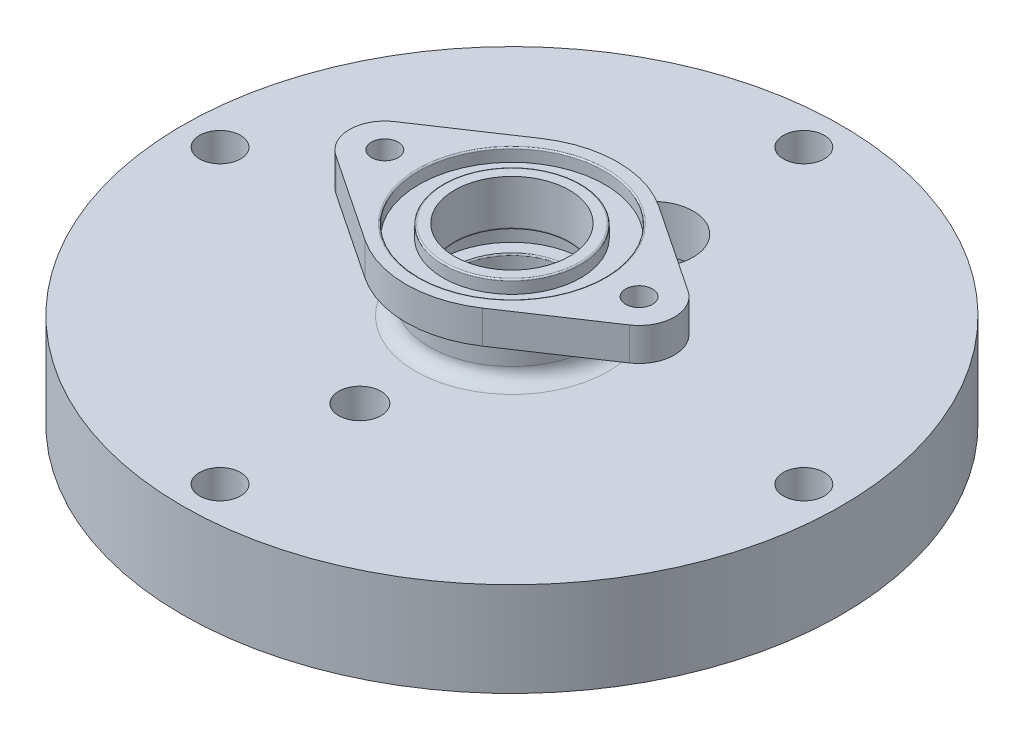
from build123d import *

# Parameters (mm, degrees)
IZIM1_R                     = 70
Y_KSEKLIK_EKSTR_ZYON1_DEPTH = 20
IZIM2_R                     = 50.03
IZIM2_R_2                   = 45
IZIM2_R_3                   = 41
IZIM2_R_4                   = 17.35
KES_EKSTR_ZYON1_DEPTH       = 10
IZIM5_R                     = 17.5
Y_KSEKLIK_EKSTR_ZYON2_DEPTH = 10
IZIM7_R                     = 2.85
Y_KSEKLIK_EKSTR_ZYON3_DEPTH = 7
IZIM8_R                     = 12.2
KES_EKSTR_ZYON3_DEPTH       = 106.683489723
IZIM9_R                     = 19.75
IZIM9_R_2                   = 14.62
KES_EKSTR_ZYON4_DEPTH       = 2.75
RADYUS1_R                   = 0.3
RADYUS2_R                   = 3
IZIM10_W                    = 3.410740466
IZIM10_H                    = 4.5
IZIM12_R                    = 4.35
KES_EKSTR_ZYON5_DEPTH       = 101.995049384
IZIM13_R                    = 8.5
KES_EKSTR_ZYON6_DEPTH       = 10
IZIM14_R                    = 50.03
IZIM14_R_2                  = 45
KES_EKSTR_ZYON7_DEPTH       = 3
IZIM15_R                    = 4.5
KES_EKSTR_ZYON9_DEPTH       = 10
IZIM16_R                    = 51
IZIM16_R_2                  = 44.25
KES_EKSTR_ZYON10_DEPTH      = 13
RADYUS3_R                   = 0.3


with BuildPart() as part:
    # Çizim1 → Yükseklik-Ekstrüzyon1 (new body)
    with BuildSketch(Plane(origin=(0, 0, 0), x_dir=(1, 0, 0), z_dir=(0, 1, 0))):
        with Locations(Location((0, 0, 0), (0, 0, 270))):
            Circle(IZIM1_R)
    extrude(amount=Y_KSEKLIK_EKSTR_ZYON1_DEPTH)

    # Çizim2 → Kes-Ekstrüzyon1 (cut)
    # profile 1 of 2: a face of its own
    with BuildSketch(Plane.XZ):
        with Locations(Location((0, 0, 0), (0, 0, 270))):
            Circle(IZIM2_R)
        with Locations(Location((0, 0, 0), (0, 0, 270))):
            Circle(IZIM2_R_2, mode=Mode.SUBTRACT)
    # profile 2 of 2: a face of its own
    with BuildSketch(Plane.XZ):
        with Locations(Location((0, 0, 0), (0, 0, 270))):
            Circle(IZIM2_R_3)
        with Locations(Location((0, 0, 0), (0, 0, 270))):
            Circle(IZIM2_R_4, mode=Mode.SUBTRACT)
    extrude(amount=-KES_EKSTR_ZYON1_DEPTH, mode=Mode.SUBTRACT)

    # Çizim4 → Kes-Döndür1 (revolve, cut)
    with BuildSketch(Plane.XY, mode=Mode.PRIVATE) as kes_d_nd_r1_sk:
        Polygon((-17.35, 10), (-17.35, 0), (-13.6, 0), align=None)
    revolve(kes_d_nd_r1_sk.sketch.rotate(Axis((0, 0, 0), (0, 1, 0)), 270), axis=Axis((0, 0, 0), (0, 1, 0)), mode=Mode.SUBTRACT)

    # Çizim5 → Yükseklik-Ekstrüzyon2 (add)
    with BuildSketch(Plane(origin=(0, 20, 0), x_dir=(1, 0, 0), z_dir=(0, 1, 0))):
        with Locations(Location((0, 0, 0), (0, 0, 270))):
            Circle(IZIM5_R)
    extrude(amount=Y_KSEKLIK_EKSTR_ZYON2_DEPTH)

    # Çizim7 → Yükseklik-Ekstrüzyon3 (add)
    with BuildSketch(Plane(origin=(0, 30, 0), x_dir=(1, 0, 0), z_dir=(0, 1, 0))):
        with BuildLine():
            Line((31.166666667, -6.236095645), (12.5, -18.708286934))
            ThreePointArc((12.5, -18.708286934), (0, -22.5), (-12.5, -18.708286934))
            Line((-12.5, -18.708286934), (-31.166666667, -6.236095645))
            ThreePointArc((-31.166666667, -6.236095645), (-34.5, 0), (-31.166666667, 6.236095645))
            Line((-31.166666667, 6.236095645), (-12.5, 18.708286934))
            ThreePointArc((-12.5, 18.708286934), (0, 22.5), (12.5, 18.708286934))
            Line((12.5, 18.708286934), (31.166666667, 6.236095645))
            ThreePointArc((31.166666667, 6.236095645), (34.5, 0), (31.166666667, -6.236095645))
        make_face()
        with Locations(Location((-27, 0, 0), (0, 0, 270))):
            Circle(IZIM7_R, mode=Mode.SUBTRACT)
        with Locations(Location((27, 0, 0), (0, 0, 270))):
            Circle(IZIM7_R, mode=Mode.SUBTRACT)
    extrude(amount=Y_KSEKLIK_EKSTR_ZYON3_DEPTH)

    # Çizim8 → Kes-Ekstrüzyon3 (cut, through all)
    with BuildSketch(Plane(origin=(0, 37, 0), x_dir=(1, 0, 0), z_dir=(0, 1, 0))):
        with Locations(Location((0, 0, 0), (0, 0, 270))):
            Circle(IZIM8_R)
    extrude(amount=-KES_EKSTR_ZYON3_DEPTH, mode=Mode.SUBTRACT)

    # Çizim9 → Kes-Ekstrüzyon4 (cut)
    with BuildSketch(Plane(origin=(0, 37, 0), x_dir=(1, 0, 0), z_dir=(0, 1, 0))):
        with Locations(Location((0, 0, 0), (0, 0, 270))):
            Circle(IZIM9_R)
        with Locations(Location((0, 0, 0), (0, 0, 270))):
            Circle(IZIM9_R_2, mode=Mode.SUBTRACT)
    extrude(amount=-KES_EKSTR_ZYON4_DEPTH, mode=Mode.SUBTRACT)

    # Radyus1
    radyus1_edges = [part.edges().sort_by_distance(p)[0] for p in [
        (0, 37, -19.75),
        (0, 37, -14.62),
    ]]
    fillet(radyus1_edges, radius=RADYUS1_R)

    # Radyus2
    radyus2_edges = [part.edges().sort_by_distance(p)[0] for p in [
        (0, 20, -17.5),
        (0, 30, -17.5),
    ]]
    fillet(radyus2_edges, radius=RADYUS2_R)

    # Çizim10 → Kes-Döndür2 (revolve, cut)
    with BuildSketch(Plane.XY, mode=Mode.PRIVATE) as kes_d_nd_r2_sk:
        with Locations((-13.534629767, 24.981859074)):
            Rectangle(IZIM10_W, IZIM10_H)
    revolve(kes_d_nd_r2_sk.sketch.rotate(Axis((0, 0, 0), (0, 1, 0)), 90), axis=Axis((0, 0, 0), (0, 1, 0)), mode=Mode.SUBTRACT)

    # Çizim12 → Kes-Ekstrüzyon5 (cut, through all)
    with BuildSketch(Plane(origin=(0, 20, 0), x_dir=(1, 0, 0), z_dir=(0, 1, 0))):
        with Locations(Location((0, 62, 0), (0, 0, 270))):
            Circle(IZIM12_R)
        with Locations(Location((62, 0, 0), (0, 0, 270))):
            Circle(IZIM12_R)
        with Locations(Location((0, -62, 0), (0, 0, 270))):
            Circle(IZIM12_R)
        with Locations(Location((-62, 0, 0), (0, 0, 270))):
            Circle(IZIM12_R)
    extrude(amount=-KES_EKSTR_ZYON5_DEPTH, mode=Mode.SUBTRACT)

    # Çizim13 → Kes-Ekstrüzyon6 (cut)
    with BuildSketch(Plane(origin=(0, 20, 0), x_dir=(1, 0, 0), z_dir=(0, 1, 0))):
        with Locations(Location((0, 30, 0), (0, 0, 270))):
            Circle(IZIM13_R)
    extrude(amount=-KES_EKSTR_ZYON6_DEPTH, mode=Mode.SUBTRACT)

    # Çizim14 → Kes-Ekstrüzyon7 (cut)
    with BuildSketch(Plane.XZ.offset(-10)):
        with Locations(Location((0, 0, 0), (0, 0, 270))):
            Circle(IZIM14_R)
        with Locations(Location((0, 0, 0), (0, 0, 270))):
            Circle(IZIM14_R_2, mode=Mode.SUBTRACT)
    extrude(amount=-KES_EKSTR_ZYON7_DEPTH, mode=Mode.SUBTRACT)

    # Çizim15 → Kes-Ekstrüzyon9 (cut)
    with BuildSketch(Plane.XZ.offset(-10)):
        with Locations(Location((0, 32.298588889, 0), (0, 0, 270))):
            Circle(IZIM15_R)
    extrude(amount=-KES_EKSTR_ZYON9_DEPTH, mode=Mode.SUBTRACT)

    # Çizim16 → Kes-Ekstrüzyon10 (cut)
    with BuildSketch(Plane.XZ):
        with Locations(Location((0, 0, 0), (0, 0, 270))):
            Circle(IZIM16_R)
        with Locations(Location((0, 0, 0), (0, 0, 270))):
            Circle(IZIM16_R_2, mode=Mode.SUBTRACT)
    extrude(amount=-KES_EKSTR_ZYON10_DEPTH, mode=Mode.SUBTRACT)

    # Radyus3
    radyus3_edges = [part.edges().sort_by_distance(p)[0] for p in [
        (0, 27.231859074, -12.2),
        (0, 22.731859074, -12.2),
    ]]
    fillet(radyus3_edges, radius=RADYUS3_R)


solid = part.part
